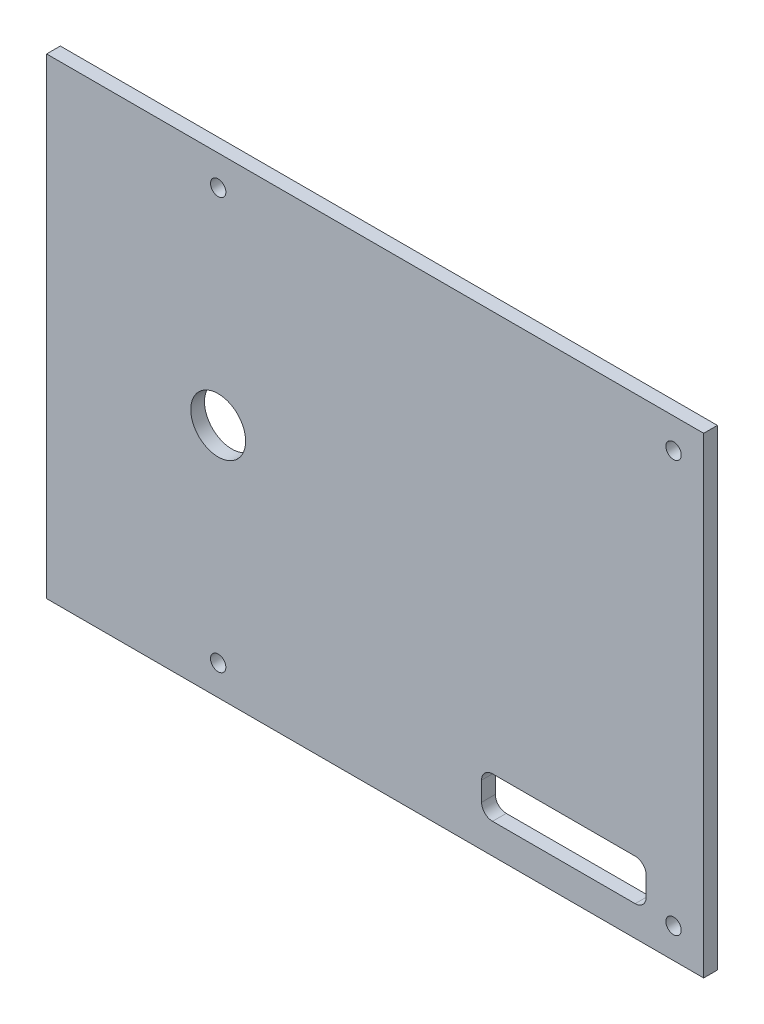
from build123d import *

# Parameters (mm, degrees)
SKETCH1_R           = 1.778
BOSS_EXTRUDE1_DEPTH = 3.175
SKETCH2_W           = 38.1
SKETCH2_H           = 9.525
CUT_EXTRUDE1_DEPTH  = 105.692755002
FILLET1_R           = 2.54
SKETCH3_R           = 6.35
CUT_EXTRUDE2_DEPTH  = 105.692755002
SKETCH4_W           = 3.175
SKETCH4_H           = 109.22
BOSS_EXTRUDE2_DEPTH = 3.175


with BuildPart() as part:
    # Sketch1 → Boss-Extrude1 (new body)
    with BuildSketch(Plane.XY):
        Polygon((-89.265, -54.61), (59.69, -54.61), (59.69, 54.61), (-89.265, 54.61), (-89.265, 9.935), align=None)
        with Locations((-52.715, -47.635)):
            Circle(SKETCH1_R, mode=Mode.SUBTRACT)
        with Locations((52.715, -47.635)):
            Circle(SKETCH1_R, mode=Mode.SUBTRACT)
        with Locations((-52.715, 47.635)):
            Circle(SKETCH1_R, mode=Mode.SUBTRACT)
        with Locations((52.715, 47.635)):
            Circle(SKETCH1_R, mode=Mode.SUBTRACT)
    extrude(amount=BOSS_EXTRUDE1_DEPTH)

    # Sketch2 → Cut-Extrude1 (cut, through all)
    with BuildSketch(Plane.XY.offset(3.175)):
        with Locations((27.315, -42.8725)):
            Rectangle(SKETCH2_W, SKETCH2_H)
    extrude(amount=-CUT_EXTRUDE1_DEPTH, mode=Mode.SUBTRACT)

    # Fillet1
    fillet1_edges = [part.edges().sort_by_distance(p)[0] for p in [
        (46.365, -47.635, 1.5875),
        (8.265, -47.635, 1.5875),
        (8.265, -38.11, 1.5875),
        (46.365, -38.11, 1.5875),
    ]]
    fillet(fillet1_edges, radius=FILLET1_R)

    # Sketch3 → Cut-Extrude2 (cut, through all)
    with BuildSketch(Plane.XY.offset(3.175)):
        with Locations((-52.715, 0)):
            Circle(SKETCH3_R)
    extrude(amount=-CUT_EXTRUDE2_DEPTH, mode=Mode.SUBTRACT)

    # Sketch4 → Boss-Extrude2 (add)
    with BuildSketch(Plane.ZY.offset(89.265)):
        with Locations((1.5875, 0)):
            Rectangle(SKETCH4_W, SKETCH4_H)
    extrude(amount=BOSS_EXTRUDE2_DEPTH)


solid = part.part
